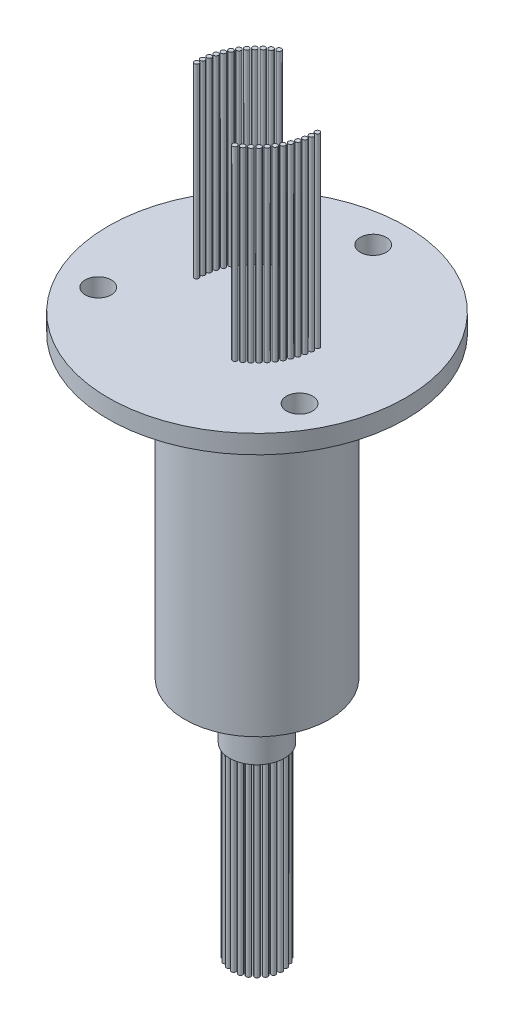
from build123d import *

# Parameters (mm, degrees)
SKETCH_2_R          = 1.4
CUT_EXTRUDE_1_DEPTH = 10
SKETCH_3_R          = 0.25
EXTRUDE_1_DEPTH     = 20
SKETCH_4_R          = 0.25
EXTRUDE_2_DEPTH     = 20


with BuildPart() as part:
    # 草图1 → 旋转1 (revolve)
    with BuildSketch(Plane.XY, mode=Mode.PRIVATE) as revolve_1_sk:
        Polygon((0, 40.1), (-16, 40.1), (-16, 38.1), (-7.75, 38.1), (-7.75, 6), (-2.95, 6), (-2.95, 0), (0, 0), align=None)
    revolve(revolve_1_sk.sketch.rotate(Axis((0, 0, 0), (0, 1, 0)), 180), axis=Axis((0, 0, 0), (0, 1, 0)))

    # 草图2 → 切除-拉伸1 (cut)
    with BuildSketch(Plane(origin=(0, 40.1, 0), x_dir=(1, 0, 0), z_dir=(0, 1, 0))):
        with Locations(Location((0, 12.5, 0), (0, 0, 180))):
            Circle(SKETCH_2_R)
        with Locations(Location((10.825317547, -6.25, 0), (0, 0, 180))):
            Circle(SKETCH_2_R)
        with Locations(Location((-10.825317547, -6.25, 0), (0, 0, 180))):
            Circle(SKETCH_2_R)
    extrude(amount=-CUT_EXTRUDE_1_DEPTH, mode=Mode.SUBTRACT)

    # 草图3 → 凸台-拉伸1 (add)
    with BuildSketch(Plane(origin=(0, 40.1, 0), x_dir=(1, 0, 0), z_dir=(0, 1, 0))):
        with Locations((-6.5, 0)):
            Circle(SKETCH_3_R)
        with Locations((6.5, 0)):
            Circle(SKETCH_3_R)
        with Locations((-6.470567497, 0.617864281)):
            Circle(SKETCH_3_R)
        with Locations((6.470567497, -0.617864281)):
            Circle(SKETCH_3_R)
        with Locations((-6.382536532, 1.230133088)):
            Circle(SKETCH_3_R)
        with Locations((6.382536532, -1.230133088)):
            Circle(SKETCH_3_R)
        with Locations((-6.236704328, 1.831261619)):
            Circle(SKETCH_3_R)
        with Locations((6.236704328, -1.831261619)):
            Circle(SKETCH_3_R)
        with Locations((-6.034391565, 2.415805962)):
            Circle(SKETCH_3_R)
        with Locations((6.034391565, -2.415805962)):
            Circle(SKETCH_3_R)
        with Locations((-5.777430416, 2.978472391)):
            Circle(SKETCH_3_R)
        with Locations((5.777430416, -2.978472391)):
            Circle(SKETCH_3_R)
        with Locations((-5.468147963, 3.514165313)):
            Circle(SKETCH_3_R)
        with Locations((5.468147963, -3.514165313)):
            Circle(SKETCH_3_R)
        with Locations((-5.109345116, 4.01803341)):
            Circle(SKETCH_3_R)
        with Locations((5.109345116, -4.01803341)):
            Circle(SKETCH_3_R)
        with Locations((-4.704271248, 4.485513575)):
            Circle(SKETCH_3_R)
        with Locations((4.704271248, -4.485513575)):
            Circle(SKETCH_3_R)
        with Locations((-4.256594771, 4.912372233)):
            Circle(SKETCH_3_R)
        with Locations((4.256594771, -4.912372233)):
            Circle(SKETCH_3_R)
        with Locations((-3.770369912, 5.294743688)):
            Circle(SKETCH_3_R)
        with Locations((3.770369912, -5.294743688)):
            Circle(SKETCH_3_R)
        with Locations((-3.25, 5.629165125)):
            Circle(SKETCH_3_R)
        with Locations((3.25, -5.629165125)):
            Circle(SKETCH_3_R)
    extrude(amount=EXTRUDE_1_DEPTH)

    # 草图4 → 凸台-拉伸2 (add)
    with BuildSketch(Plane.XZ):
        with Locations(Location((0, -2.5, 0), (0, 0, 180))):
            Circle(SKETCH_4_R)
        with Locations(Location((-0.647047613, -2.414814566, 0), (0, 0, 180))):
            Circle(SKETCH_4_R)
        with Locations(Location((-1.25, -2.165063509, 0), (0, 0, 180))):
            Circle(SKETCH_4_R)
        with Locations(Location((-1.767766953, -1.767766953, 0), (0, 0, 180))):
            Circle(SKETCH_4_R)
        with Locations(Location((-2.165063509, -1.25, 0), (0, 0, 180))):
            Circle(SKETCH_4_R)
        with Locations(Location((-2.414814566, -0.647047613, 0), (0, 0, 180))):
            Circle(SKETCH_4_R)
        with Locations(Location((-2.5, 0, 0), (0, 0, 180))):
            Circle(SKETCH_4_R)
        with Locations(Location((-2.414814566, 0.647047613, 0), (0, 0, 180))):
            Circle(SKETCH_4_R)
        with Locations(Location((-2.165063509, 1.25, 0), (0, 0, 180))):
            Circle(SKETCH_4_R)
        with Locations(Location((-1.767766953, 1.767766953, 0), (0, 0, 180))):
            Circle(SKETCH_4_R)
        with Locations(Location((-1.25, 2.165063509, 0), (0, 0, 180))):
            Circle(SKETCH_4_R)
        with Locations(Location((-0.647047613, 2.414814566, 0), (0, 0, 180))):
            Circle(SKETCH_4_R)
        with Locations(Location((0, 2.5, 0), (0, 0, 180))):
            Circle(SKETCH_4_R)
        with Locations(Location((0.647047613, 2.414814566, 0), (0, 0, 180))):
            Circle(SKETCH_4_R)
        with Locations(Location((1.25, 2.165063509, 0), (0, 0, 180))):
            Circle(SKETCH_4_R)
        with Locations(Location((1.767766953, 1.767766953, 0), (0, 0, 180))):
            Circle(SKETCH_4_R)
        with Locations(Location((2.165063509, 1.25, 0), (0, 0, 180))):
            Circle(SKETCH_4_R)
        with Locations(Location((2.414814566, 0.647047613, 0), (0, 0, 180))):
            Circle(SKETCH_4_R)
        with Locations(Location((2.5, 0, 0), (0, 0, 180))):
            Circle(SKETCH_4_R)
        with Locations(Location((2.414814566, -0.647047613, 0), (0, 0, 180))):
            Circle(SKETCH_4_R)
        with Locations(Location((2.165063509, -1.25, 0), (0, 0, 180))):
            Circle(SKETCH_4_R)
        with Locations(Location((1.767766953, -1.767766953, 0), (0, 0, 180))):
            Circle(SKETCH_4_R)
        with Locations(Location((1.25, -2.165063509, 0), (0, 0, 180))):
            Circle(SKETCH_4_R)
        with Locations(Location((0.647047613, -2.414814566, 0), (0, 0, 180))):
            Circle(SKETCH_4_R)
    extrude(amount=EXTRUDE_2_DEPTH)


solid = part.part
